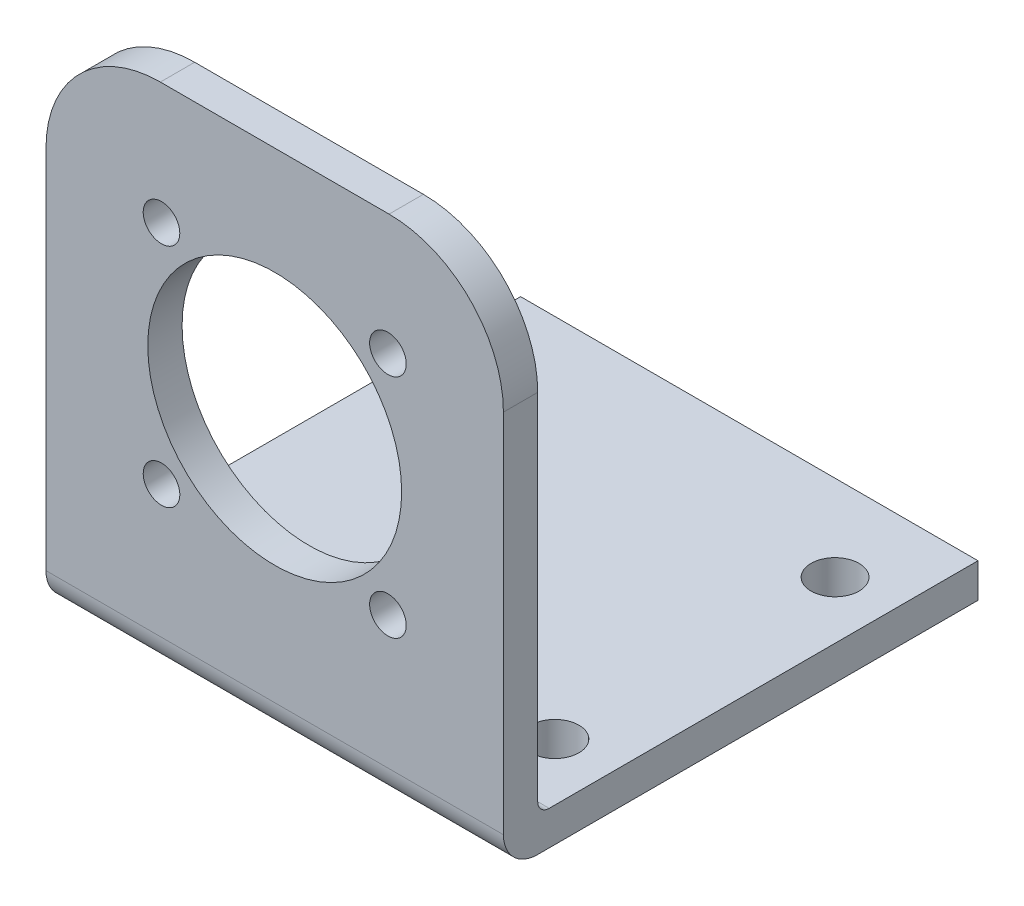
from build123d import *

# Parameters (mm, degrees)
SKETCH_1_W          = 40
SKETCH_1_H          = 45
SKETCH_1_R          = 11.1
SKETCH_1_R_2        = 1.6
EXTRUDE_1_DEPTH     = 3
SKETCH_2_W          = 40
SKETCH_2_H          = 3
EXTRUDE_2_DEPTH     = 41.5
SKETCH_3_R          = 2.1
CUT_EXTRUDE_1_DEPTH = 61.384186672
FILLET_1_R          = 10
FILLET_3_R          = 3
FILLET_4_R          = 1


with BuildPart() as part:
    # 草图1 → 凸台-拉伸1 (new body)
    with BuildSketch(Plane.XY):
        with Locations((0, -2)):
            Rectangle(SKETCH_1_W, SKETCH_1_H)
        Circle(SKETCH_1_R, mode=Mode.SUBTRACT)
        with Locations((-9.899494937, 9.899494937)):
            Circle(SKETCH_1_R_2, mode=Mode.SUBTRACT)
        with Locations(Location((9.899494937, 9.899494937, 0), (0, 0, 180))):
            Circle(SKETCH_1_R_2, mode=Mode.SUBTRACT)
        with Locations(Location((-9.899494937, -9.899494937, 0), (0, 0, 180))):
            Circle(SKETCH_1_R_2, mode=Mode.SUBTRACT)
        with Locations((9.899494937, -9.899494937)):
            Circle(SKETCH_1_R_2, mode=Mode.SUBTRACT)
    extrude(amount=EXTRUDE_1_DEPTH)

    # 草图2 → 凸台-拉伸2 (add)
    with BuildSketch(Plane.XY.offset(3)):
        with Locations((0, -23)):
            Rectangle(SKETCH_2_W, SKETCH_2_H)
    extrude(amount=-EXTRUDE_2_DEPTH)

    # 草图3 → 切除-拉伸1 (cut, through all)
    with BuildSketch(Plane(origin=(0, -21.5, 0), x_dir=(1, 0, 0), z_dir=(0, 1, 0))):
        with Locations(Location((-15, 31, 0), (0, 0, 180))):
            Circle(SKETCH_3_R)
        with Locations((15, 31)):
            Circle(SKETCH_3_R)
        with Locations((15, 6.5)):
            Circle(SKETCH_3_R)
        with Locations(Location((-15, 6.5, 0), (0, 0, 180))):
            Circle(SKETCH_3_R)
    extrude(amount=-CUT_EXTRUDE_1_DEPTH, mode=Mode.SUBTRACT)

    # 圆角1
    fillet_1_edges = [part.edges().sort_by_distance(p)[0] for p in [
        (-20, 20.5, 1.5),
        (20, 20.5, 1.5),
    ]]
    fillet(fillet_1_edges, radius=FILLET_1_R)

    # 圆角3
    fillet_3_edges = [part.edges().sort_by_distance(p)[0] for p in [
        (0, -24.5, 3),
    ]]
    fillet(fillet_3_edges, radius=FILLET_3_R)

    # 圆角4
    fillet_4_edges = [part.edges().sort_by_distance(p)[0] for p in [
        (0, -21.5, 0),
    ]]
    fillet(fillet_4_edges, radius=FILLET_4_R)


solid = part.part
